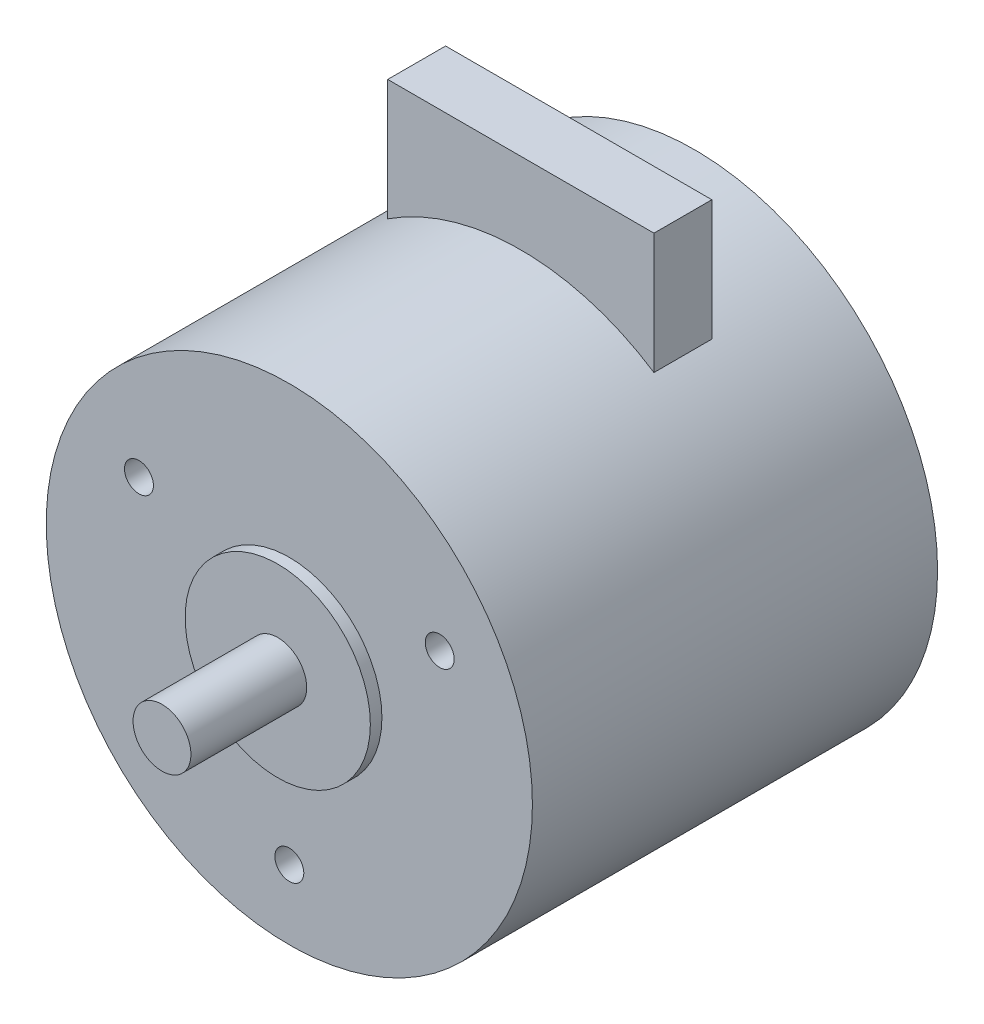
from build123d import *

# Parameters (mm, degrees)
SKETCH1_R           = 21
BOSS_EXTRUDE1_DEPTH = 35
SKETCH2_R           = 8
BOSS_EXTRUDE2_DEPTH = 1
SKETCH3_R           = 2.5
BOSS_EXTRUDE3_DEPTH = 10
BOSS_EXTRUDE4_START = -10
SKETCH4_W           = 23
SKETCH4_H           = 14.139392284
BOSS_EXTRUDE4_DEPTH = 5
SKETCH6_R           = 1.25
CUT_EXTRUDE1_DEPTH  = 5


with BuildPart() as part:
    # Sketch1 → Boss-Extrude1 (new body)
    with BuildSketch(Plane.XY):
        Circle(SKETCH1_R)
    extrude(amount=BOSS_EXTRUDE1_DEPTH)

    # Sketch2 → Boss-Extrude2 (add)
    with BuildSketch(Plane.XY.offset(35)):
        Circle(SKETCH2_R)
    extrude(amount=BOSS_EXTRUDE2_DEPTH)

    # Sketch3 → Boss-Extrude3 (add)
    with BuildSketch(Plane.XY.offset(36)):
        Circle(SKETCH3_R)
    extrude(amount=BOSS_EXTRUDE3_DEPTH)

    # Sketch4 → Boss-Extrude4 (add)
    with BuildSketch(Plane(origin=(0, 0, 0), x_dir=(-1, 0, 0), z_dir=(0, 0, -1)).offset(BOSS_EXTRUDE4_START)):
        with Locations((0, 20.930303858)):
            Rectangle(SKETCH4_W, SKETCH4_H)
    extrude(amount=-BOSS_EXTRUDE4_DEPTH)

    # Sketch6 → Cut-Extrude1 (cut)
    with BuildSketch(Plane.XY.offset(35)):
        with Locations((0, -15)):
            Circle(SKETCH6_R)
        with Locations((-12.990381057, 7.5)):
            Circle(SKETCH6_R)
        with Locations((12.990381057, 7.5)):
            Circle(SKETCH6_R)
    extrude(amount=-CUT_EXTRUDE1_DEPTH, mode=Mode.SUBTRACT)


solid = part.part
